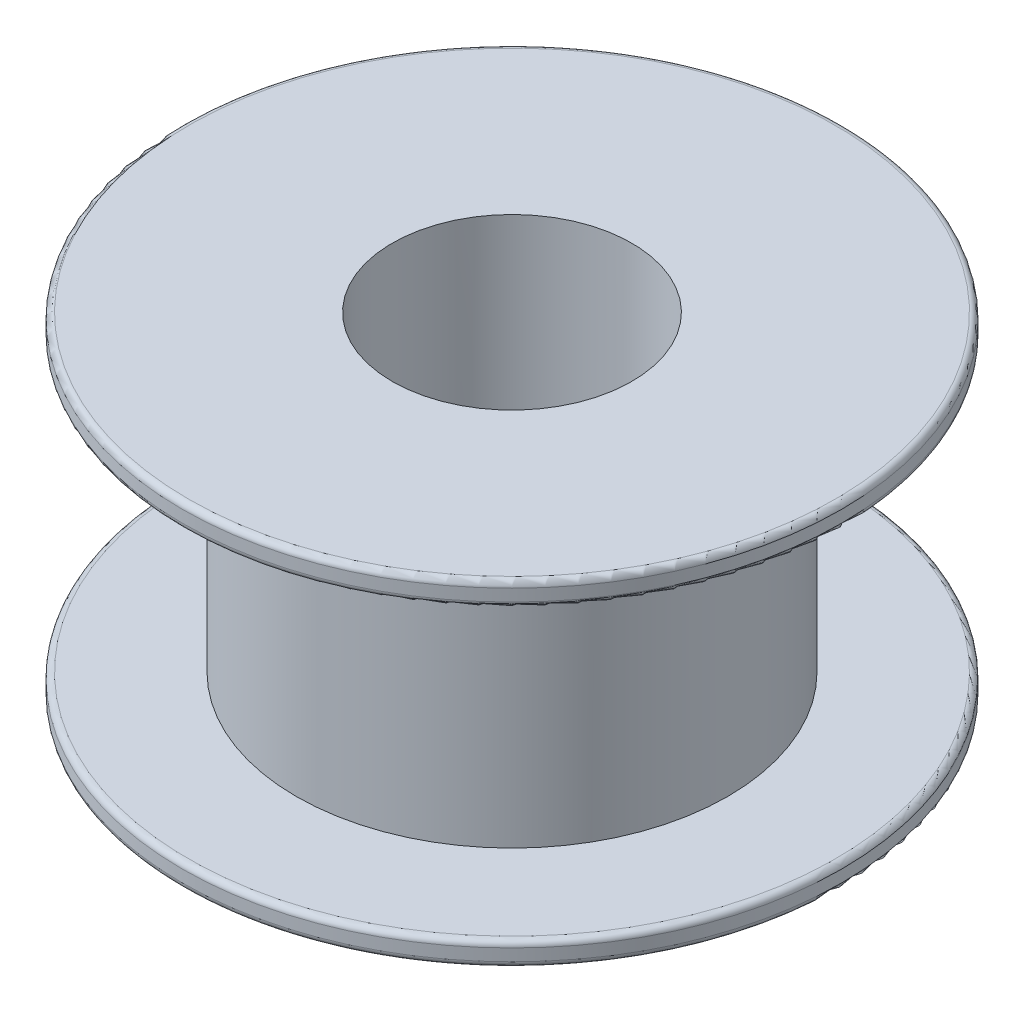
from build123d import *

# Parameters (mm, degrees)
SKETCH_1_R      = 27.5
SKETCH_1_R_2    = 10
EXTRUDE_1_DEPTH = 2
SKETCH_2_R      = 18
SKETCH_2_R_2    = 10
EXTRUDE_2_DEPTH = 24
SKETCH_3_R      = 27.5
SKETCH_3_R_2    = 10
EXTRUDE_3_DEPTH = 2
FILLET_1_R      = 0.5


with BuildPart() as part:
    # 草图1 → 凸台-拉伸1 (new body)
    with BuildSketch(Plane(origin=(0, 0, 0), x_dir=(1, 0, 0), z_dir=(0, 1, 0))):
        with Locations(Location((0, 0, 0), (0, 0, 270))):
            Circle(SKETCH_1_R)
        with Locations(Location((0, 0, 0), (0, 0, 270))):
            Circle(SKETCH_1_R_2, mode=Mode.SUBTRACT)
    extrude(amount=-EXTRUDE_1_DEPTH)

    # 草图2 → 凸台-拉伸2 (add)
    with BuildSketch(Plane.XZ.offset(2)):
        with Locations(Location((0, 0, 0), (0, 0, 90))):
            Circle(SKETCH_2_R)
        with Locations(Location((0, 0, 0), (0, 0, 90))):
            Circle(SKETCH_2_R_2, mode=Mode.SUBTRACT)
    extrude(amount=EXTRUDE_2_DEPTH)

    # 草图3 → 凸台-拉伸3 (add)
    with BuildSketch(Plane.XZ.offset(26)):
        with Locations(Location((0, 0, 0), (0, 0, 90))):
            Circle(SKETCH_3_R)
        with Locations(Location((0, 0, 0), (0, 0, 90))):
            Circle(SKETCH_3_R_2, mode=Mode.SUBTRACT)
    extrude(amount=EXTRUDE_3_DEPTH)

    # 圆角1
    fillet_1_edges = [part.edges().sort_by_distance(p)[0] for p in [
        (0, -28, -27.5),
        (0, -26, -27.5),
        (0, 0, -27.5),
        (0, -2, -27.5),
    ]]
    fillet(fillet_1_edges, radius=FILLET_1_R)


solid = part.part
